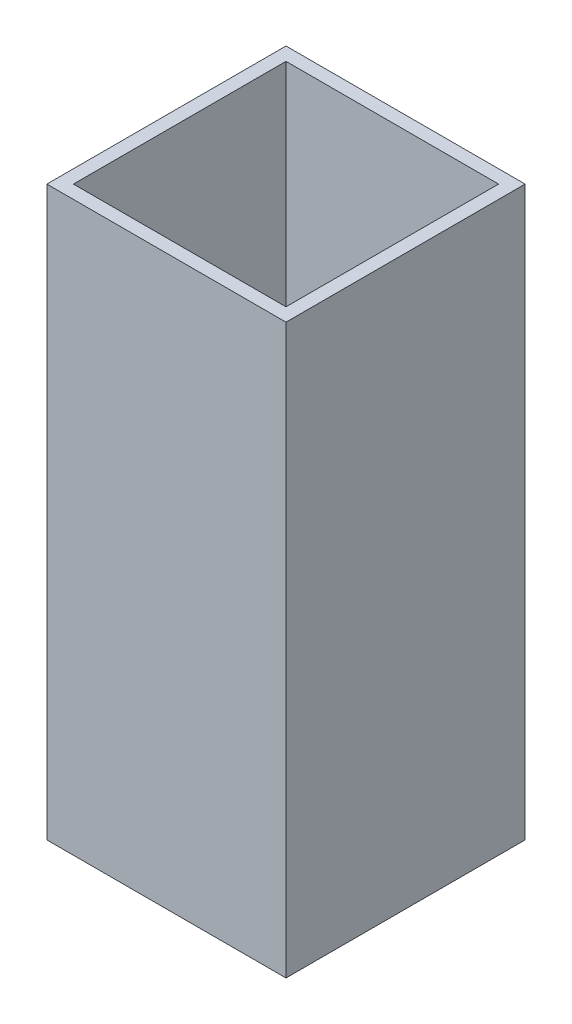
from build123d import *

# Parameters (mm, degrees)
SKETCH1_W            = 36
SKETCH1_H            = 36
SKETCH1_W_2          = 32
SKETCH1_H_2          = 32
BOSS_EXTRUDE1_DEPTH  = 10
SKETCH5_W            = 36
SKETCH5_H            = 36
SKETCH5_W_2          = 32
SKETCH5_H_2          = 32
BOSS_EXTRUDE5_DEPTH  = 63.5
SKETCH2_W            = 36
SKETCH2_H            = 36
SKETCH2_W_2          = 28
SKETCH2_H_2          = 28
BOSS_EXTRUDE9_DEPTH  = 2
SKETCH9_W            = 36
SKETCH9_H            = 36
SKETCH9_W_2          = 32
SKETCH9_H_2          = 32
BOSS_EXTRUDE11_DEPTH = 10


with BuildPart() as part:
    # Sketch1 → Boss-Extrude1 (new body)
    with BuildSketch(Plane(origin=(0, 0, 0), x_dir=(1, 0, 0), z_dir=(0, 1, 0))):
        with Locations((-61.04447382, 32.009277239)):
            Rectangle(SKETCH1_W, SKETCH1_H)
        with Locations((-61.04447382, 32.009277239)):
            Rectangle(SKETCH1_W_2, SKETCH1_H_2, mode=Mode.SUBTRACT)
    extrude(amount=BOSS_EXTRUDE1_DEPTH)

    # Sketch5 → Boss-Extrude5 (add)
    with BuildSketch(Plane(origin=(0, 10, 0), x_dir=(1, 0, 0), z_dir=(0, 1, 0))):
        with Locations((-61.04447382, 32.009277239)):
            Rectangle(SKETCH5_W, SKETCH5_H)
        with Locations((-61.04447382, 32.009277239)):
            Rectangle(SKETCH5_W_2, SKETCH5_H_2, mode=Mode.SUBTRACT)
    extrude(amount=BOSS_EXTRUDE5_DEPTH)

    # Sketch2 → Boss-Extrude9 (add)
    with BuildSketch(Plane.XZ):
        with Locations((-61.04447382, -32.009277239)):
            Rectangle(SKETCH2_W, SKETCH2_H)
        with Locations((-61.04447382, -32.009277239)):
            Rectangle(SKETCH2_W_2, SKETCH2_H_2, mode=Mode.SUBTRACT)
    extrude(amount=BOSS_EXTRUDE9_DEPTH)

    # Sketch9 → Boss-Extrude11 (add)
    with BuildSketch(Plane.XZ.offset(2)):
        with Locations((-61.04447382, -32.009277239)):
            Rectangle(SKETCH9_W, SKETCH9_H)
        with Locations((-61.04447382, -32.009277239)):
            Rectangle(SKETCH9_W_2, SKETCH9_H_2, mode=Mode.SUBTRACT)
    extrude(amount=BOSS_EXTRUDE11_DEPTH)


solid = part.part
